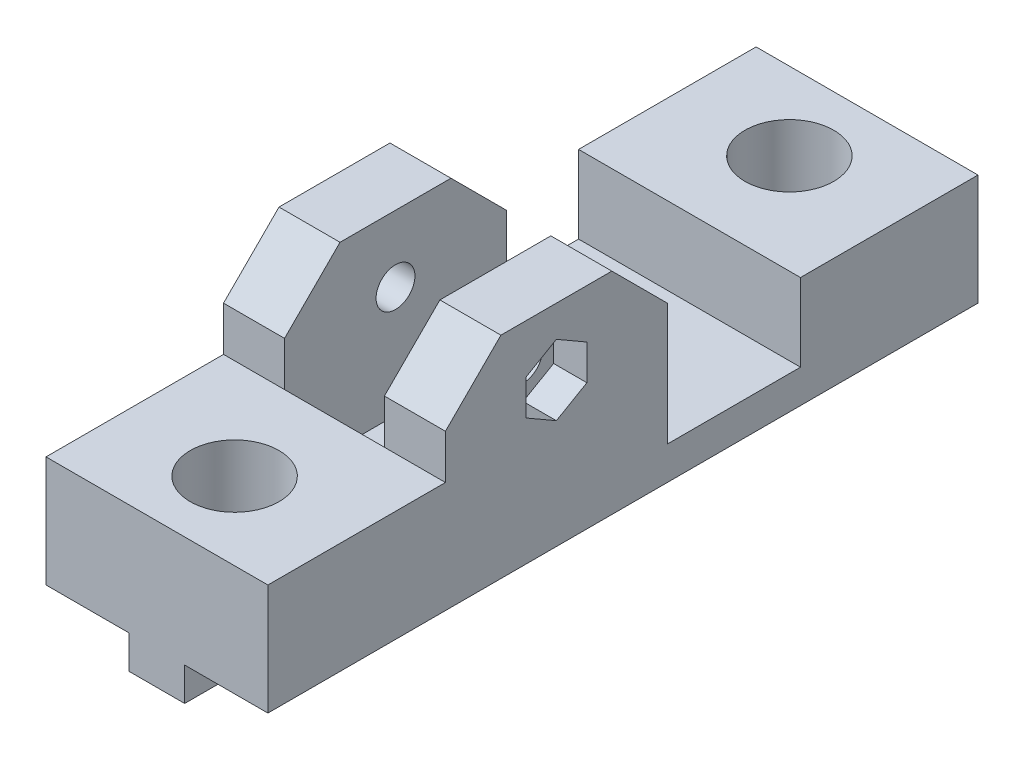
from build123d import *

# Parameters (mm, degrees)
SKETCH1_W               = 20
SKETCH1_H               = 30
BOSS_EXTRUDE1_DEPTH     = 3
SKETCH2_W               = 5
SKETCH2_H               = 12
BOSS_EXTRUDE2_DEPTH     = 3
SKETCH3_R               = 7
SKETCH3_R_2             = 4
BOSS_EXTRUDE3_DEPTH     = 7
SKETCH4_R               = 4
BOSS_EXTRUDE4_DEPTH     = 1
CUT_EXTRUDE1_DEPTH      = 20.339079606
CUT_EXTRUDE1_DEPTH_BACK = 20.339079606
SKETCH5_R               = 3
SKETCH6_R               = 7
SKETCH6_R_2             = 4
BOSS_EXTRUDE6_DEPTH     = 7
SKETCH7_W               = 20
SKETCH7_H               = 3
BOSS_EXTRUDE7_DEPTH     = 19
SKETCH8_W               = 5
SKETCH8_H               = 3
BOSS_EXTRUDE8_DEPTH     = 12
SKETCH10_W              = 5.5
SKETCH10_H              = 20
BOSS_EXTRUDE9_DEPTH     = 16
CUT_EXTRUDE2_DEPTH      = 57.231663678
CUT_EXTRUDE2_DEPTH_BACK = 57.231663678
SKETCH11_R              = 1.75
SKETCH12_R              = 3
SKETCH12_R_2            = 1.75
CUT_EXTRUDE3_DEPTH      = 3
CUT_EXTRUDE4_START      = -3
SKETCH13_R              = 1.75
CUT_EXTRUDE4_DEPTH      = 3
CHAMFER2_SIZE           = 5


with BuildPart() as part:
    # Sketch1 → Boss-Extrude1 (new body)
    with BuildSketch(Plane(origin=(0, 0, 0), x_dir=(1, 0, 0), z_dir=(0, 1, 0))):
        Rectangle(SKETCH1_W, SKETCH1_H)
    boss_extrude1 = extrude(amount=BOSS_EXTRUDE1_DEPTH)

    # Sketch2 → Boss-Extrude2 (add)
    with BuildSketch(Plane.XZ):
        with Locations((0, -9)):
            Rectangle(SKETCH2_W, SKETCH2_H)
    boss_extrude2 = extrude(amount=BOSS_EXTRUDE2_DEPTH)

    # Sketch3 → Boss-Extrude3 (add)
    with BuildSketch(Plane(origin=(0, 3, 0), x_dir=(1, 0, 0), z_dir=(0, 1, 0))):
        with Locations(Location((0, 8, 0), (0, 0, 90))):
            Circle(SKETCH3_R)
        with Locations(Location((0, 8, 0), (0, 0, 270))):
            Circle(SKETCH3_R_2, mode=Mode.SUBTRACT)
    boss_extrude3 = extrude(amount=BOSS_EXTRUDE3_DEPTH)

    # Sketch4 → Boss-Extrude4 (add)
    with BuildSketch(Plane(origin=(0, 3, 0), x_dir=(1, 0, 0), z_dir=(0, 1, 0))):
        with Locations(Location((0, 8, 0), (0, 0, 270))):
            Circle(SKETCH4_R)
    boss_extrude4 = extrude(amount=BOSS_EXTRUDE4_DEPTH)

    # Sketch5 → Cut-Extrude1 (cut, two sides: drawn at the far end of the back side and taken through both)
    with BuildSketch(Plane(origin=(0, 3, 0), x_dir=(1, 0, 0), z_dir=(0, 1, 0)).offset(-CUT_EXTRUDE1_DEPTH_BACK)):
        with Locations(Location((0, -8.5, 0), (0, 0, 90))):
            Circle(SKETCH5_R)
    extrude(amount=CUT_EXTRUDE1_DEPTH + CUT_EXTRUDE1_DEPTH_BACK, mode=Mode.SUBTRACT)

    # Sketch6 → Boss-Extrude6 (add)
    # profile 1 of 2: a face of its own
    with BuildSketch(Plane(origin=(0, 3, 0), x_dir=(1, 0, 0), z_dir=(0, 1, 0))):
        Polygon((0, 15), (-10, 15), (-10, -1), (10, -1), (10, 15), align=None)
        with BuildLine():
            ThreePointArc((7, 8), (-4.949747468, 3.050252532), (0, 15))
            ThreePointArc((0, 15), (4.949747468, 12.949747468), (7, 8))
        make_face(mode=Mode.SUBTRACT)
    # profile 2 of 2: a face of its own
    with BuildSketch(Plane(origin=(0, 3, 0), x_dir=(1, 0, 0), z_dir=(0, 1, 0))):
        with Locations((0, 8)):
            Circle(SKETCH6_R)
        with Locations(Location((0, 8, 0), (0, 0, 270))):
            Circle(SKETCH6_R_2, mode=Mode.SUBTRACT)
    boss_extrude6 = extrude(amount=BOSS_EXTRUDE6_DEPTH)

    # Sketch7 → Boss-Extrude7 (add)
    with BuildSketch(Plane.XY.offset(15)):
        with Locations((0, 1.5)):
            Rectangle(SKETCH7_W, SKETCH7_H)
    extrude(amount=BOSS_EXTRUDE7_DEPTH)

    # Mirror3: Boss-Extrude1, Boss-Extrude2, Boss-Extrude3, Boss-Extrude4, Boss-Extrude6 across plane
    add(boss_extrude1.mirror(Plane.XY.offset(17)))
    add(boss_extrude2.mirror(Plane.XY.offset(17)))
    add(boss_extrude3.mirror(Plane.XY.offset(17)))
    add(boss_extrude4.mirror(Plane.XY.offset(17)))
    add(boss_extrude6.mirror(Plane.XY.offset(17)))

    # Sketch8 → Boss-Extrude8 (add)
    with BuildSketch(Plane(origin=(0, 0, 37), x_dir=(-1, 0, 0), z_dir=(0, 0, -1))):
        with Locations((0, -1.5)):
            Rectangle(SKETCH8_W, SKETCH8_H)
    extrude(amount=BOSS_EXTRUDE8_DEPTH)

    # Sketch10 → Boss-Extrude9 (add)
    with BuildSketch(Plane(origin=(0, 3, 0), x_dir=(1, 0, 0), z_dir=(0, 1, 0))):
        with Locations((-7.25, -23)):
            Rectangle(SKETCH10_W, SKETCH10_H)
        with Locations((7.25, -23)):
            Rectangle(SKETCH10_W, SKETCH10_H)
    extrude(amount=BOSS_EXTRUDE9_DEPTH)

    # Sketch11 → Cut-Extrude2 (cut, two sides: drawn at the far end of the back side and taken through both)
    with BuildSketch(Plane.ZY.offset(10).offset(-CUT_EXTRUDE2_DEPTH_BACK)):
        with Locations((23, 13)):
            Circle(SKETCH11_R)
    extrude(amount=CUT_EXTRUDE2_DEPTH + CUT_EXTRUDE2_DEPTH_BACK, mode=Mode.SUBTRACT)

    # Sketch12 → Cut-Extrude3 (cut)
    with BuildSketch(Plane.ZY.offset(10)):
        with Locations((23, 13)):
            Circle(SKETCH12_R)
        with Locations((23, 13)):
            Circle(SKETCH12_R_2, mode=Mode.SUBTRACT)
    extrude(amount=-CUT_EXTRUDE3_DEPTH, mode=Mode.SUBTRACT)

    # Sketch13 → Cut-Extrude4 (cut)
    with BuildSketch(Plane(origin=(10, 0, 0), x_dir=(0, 0, -1), z_dir=(1, 0, 0)).offset(CUT_EXTRUDE4_START)):
        Polygon((-23, 16.175426481), (-25.75, 14.58771324), (-25.75, 11.41228676), (-23, 9.824573519), (-20.25, 11.41228676), (-20.25, 14.58771324), align=None)
        with Locations((-23, 13)):
            Circle(SKETCH13_R, mode=Mode.SUBTRACT)
    extrude(amount=CUT_EXTRUDE4_DEPTH, mode=Mode.SUBTRACT)

    # Chamfer2
    chamfer2_edges = [part.edges().sort_by_distance(p)[0] for p in [
        (-7.25, 19, 13),
        (-7.25, 19, 33),
        (7.25, 19, 13),
        (7.25, 19, 33),
    ]]
    chamfer(chamfer2_edges, length=CHAMFER2_SIZE)


solid = part.part
